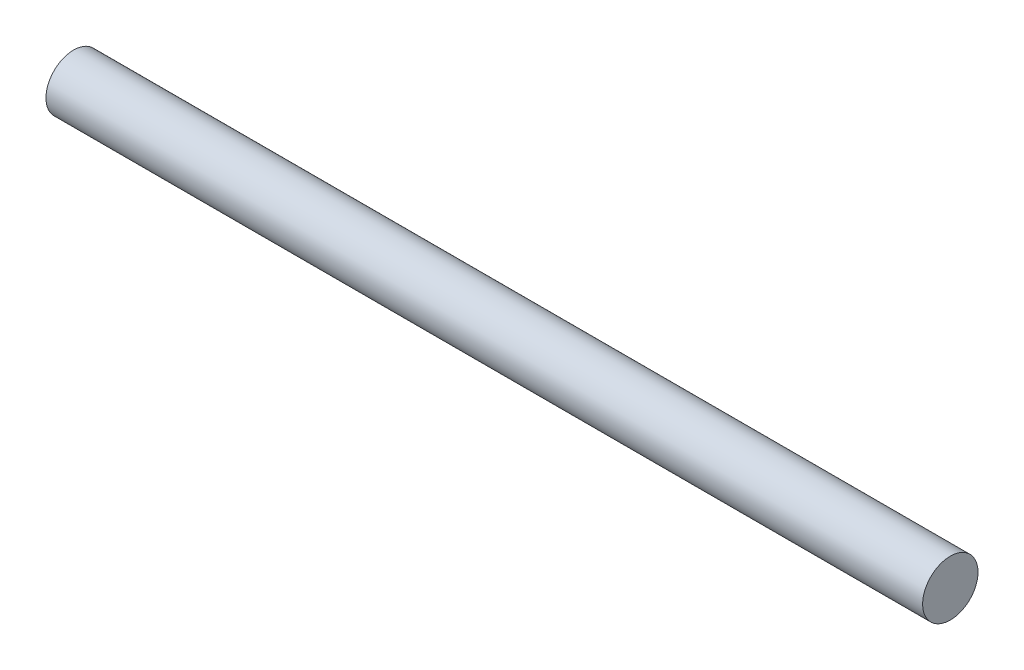
from build123d import *

# Parameters (mm, degrees)
BOSS_EXTRUDE1_DEPTH      = 1417.32895917
BOSS_EXTRUDE1_DEPTH_BACK = 165.657180513
SKETCH1_R                = 50


with BuildPart() as part:
    # Sketch1 → Boss-Extrude1 (new, two sides: drawn at the far end of the back side and taken through both)
    with BuildSketch(Plane(origin=(0, 0, 0), x_dir=(0, 0, -1), z_dir=(1, 0, 0)).offset(-BOSS_EXTRUDE1_DEPTH_BACK)):
        Circle(SKETCH1_R)
    extrude(amount=BOSS_EXTRUDE1_DEPTH + BOSS_EXTRUDE1_DEPTH_BACK)


solid = part.part
